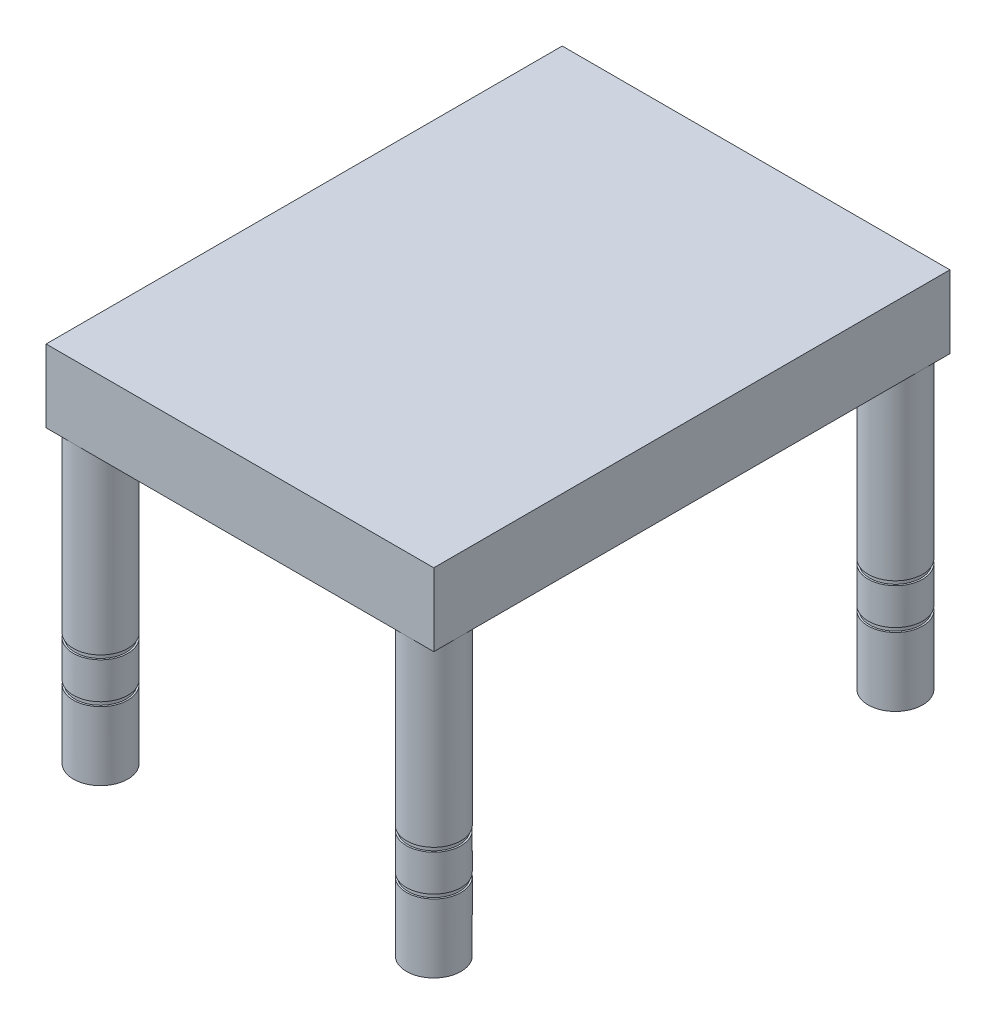
from build123d import *

# Parameters (mm, degrees)
SKETCH1_R             = 4.7625
BOSS_EXTRUDE1_DEPTH   = 50.8
BOSS_EXTRUDE1_2_DEPTH = 50.8
BOSS_EXTRUDE1_3_DEPTH = 50.8
BOSS_EXTRUDE1_4_DEPTH = 50.8
SKETCH2_W             = 67.765000106
SKETCH2_H             = 90.2184886
BOSS_EXTRUDE2_DEPTH   = 12.7
CUT_EXTRUDE1_START    = -0.7366
F_3DSKETCH1_R         = 4.7625
CUT_EXTRUDE1_DEPTH    = 0.7366
SKETCH3_R             = 4.4704
BOSS_EXTRUDE3_DEPTH   = 0.7366
F_3DSKETCH2_R         = 5.08
CUT_EXTRUDE2_DEPTH    = 0.7366
SKETCH4_R             = 4.4704
BOSS_EXTRUDE4_DEPTH   = 0.7366


with BuildPart() as part:
    # Sketch1 → Boss-Extrude1 (new body)
    with BuildSketch(Plane(origin=(0, 0, 0), x_dir=(1, 0, 0), z_dir=(0, 1, 0))):
        with Locations(Location((-29.1199951, 40.3467443, 0), (0, 0, 270))):
            Circle(SKETCH1_R)
    extrude(amount=BOSS_EXTRUDE1_DEPTH)



with BuildPart() as body_2:
    # Sketch1 → Boss-Extrude1 2 (new body)
    with BuildSketch(Plane(origin=(0, 0, 0), x_dir=(1, 0, 0), z_dir=(0, 1, 0))):
        with Locations(Location((-29.1199951, -40.3467443, 0), (0, 0, 270))):
            Circle(SKETCH1_R)
    extrude(amount=BOSS_EXTRUDE1_2_DEPTH)


with BuildPart() as body_3:
    # Sketch1 → Boss-Extrude1 3 (new body)
    with BuildSketch(Plane(origin=(0, 0, 0), x_dir=(1, 0, 0), z_dir=(0, 1, 0))):
        with Locations(Location((29.120005006, -40.3467443, 0), (0, 0, 270))):
            Circle(SKETCH1_R)
    extrude(amount=BOSS_EXTRUDE1_3_DEPTH)


with BuildPart() as body_4:
    # Sketch1 → Boss-Extrude1 4 (new body)
    with BuildSketch(Plane(origin=(0, 0, 0), x_dir=(1, 0, 0), z_dir=(0, 1, 0))):
        with Locations(Location((29.120005006, 40.3467443, 0), (0, 0, 270))):
            Circle(SKETCH1_R)
    extrude(amount=BOSS_EXTRUDE1_4_DEPTH)


with BuildPart() as part_1:
    add(part.part)

    add(body_2.part)  # Boss-Extrude2 merges body 2

    add(body_3.part)  # Boss-Extrude2 merges body 3

    add(body_4.part)  # Boss-Extrude2 merges body 4
    # Sketch2 → Boss-Extrude2 (add)
    with BuildSketch(Plane(origin=(0, 50.8, 0), x_dir=(1, 0, 0), z_dir=(0, 1, 0))):
        with Locations((4.953e-06, 0)):
            Rectangle(SKETCH2_W, SKETCH2_H)
    extrude(amount=BOSS_EXTRUDE2_DEPTH)

    # 3DSketch1 → Cut-Extrude1 (cut)
    with BuildSketch(Plane(origin=(-29.1199951, 12.7, 40.3467443), x_dir=(0.5852354085547554, 0, -0.8108634389178911), z_dir=(0, 1, 0)).offset(CUT_EXTRUDE1_START)):
        with Locations(Location((0, 0, 0), (0, 0, 35.819622287))):
            Circle(F_3DSKETCH1_R)
        with Locations(Location((34.084110256, -47.224686769, 0), (0, 0, 35.819622287))):
            Circle(F_3DSKETCH1_R)
        with Locations(Location((99.515509921, 0, 0), (0, 0, 35.819622287))):
            Circle(F_3DSKETCH1_R)
        with Locations(Location((65.431399664, 47.224686769, 0), (0, 0, 35.819622287))):
            Circle(F_3DSKETCH1_R)
    extrude(amount=CUT_EXTRUDE1_DEPTH, mode=Mode.SUBTRACT)


with BuildPart() as cut_extrude1_piece_1:
    # of the separate pieces the step leaves, piece 1, a body of its own (cut_extrude1_pieces)
    add(part_1.part.solids().sort_by_distance((-29.1199951, 12.7, -35.5842443))[0])



with BuildPart() as cut_extrude1_piece_2:
    # of the separate pieces the step leaves, piece 2, a body of its own (cut_extrude1_pieces)
    add(part_1.part.solids().sort_by_distance((-29.1199951, 0, 45.1092443))[0])


with BuildPart() as cut_extrude1_piece_3:
    # of the separate pieces the step leaves, piece 3, a body of its own (cut_extrude1_pieces)
    add(part_1.part.solids().sort_by_distance((-29.1199951, 0, -35.5842443))[0])


with BuildPart() as cut_extrude1_piece_4:
    # of the separate pieces the step leaves, piece 4, a body of its own (cut_extrude1_pieces)
    add(part_1.part.solids().sort_by_distance((29.120005006, 0, -35.5842443))[0])


with BuildPart() as cut_extrude1_piece_5:
    # of the separate pieces the step leaves, piece 5, a body of its own (cut_extrude1_pieces)
    add(part_1.part.solids().sort_by_distance((29.120005006, 0, 45.1092443))[0])


with BuildPart() as cut_extrude1_piece_1_1:
    add(cut_extrude1_piece_1.part)

    add(cut_extrude1_piece_2.part)  # Boss-Extrude3 merges Cut-Extrude1 piece 2

    add(cut_extrude1_piece_3.part)  # Boss-Extrude3 merges Cut-Extrude1 piece 3

    add(cut_extrude1_piece_4.part)  # Boss-Extrude3 merges Cut-Extrude1 piece 4

    add(cut_extrude1_piece_5.part)  # Boss-Extrude3 merges Cut-Extrude1 piece 5
    # Sketch3 → Boss-Extrude3 (add)
    with BuildSketch(Plane(origin=(0, 12.7, 0), x_dir=(-1, 0, 0), z_dir=(0, -1, 0))):
        with Locations(Location((29.1199951, 40.3467443, 0), (0, 0, 90))):
            Circle(SKETCH3_R)
        with Locations(Location((-29.120005006, 40.3467443, 0), (0, 0, 90))):
            Circle(SKETCH3_R)
        with Locations(Location((-29.120005006, -40.3467443, 0), (0, 0, 90))):
            Circle(SKETCH3_R)
        with Locations(Location((29.1199951, -40.3467443, 0), (0, 0, 90))):
            Circle(SKETCH3_R)
    extrude(amount=BOSS_EXTRUDE3_DEPTH)

    # 3DSketch2 → Cut-Extrude2 (cut)
    with BuildSketch(Plane(origin=(-29.1199951, 19.05, 40.3467443), x_dir=(0.5852354085547554, 0, -0.8108634389178911), z_dir=(0, 1, 0))):
        Circle(F_3DSKETCH2_R)
        with Locations((34.084110256, -47.224686769)):
            Circle(F_3DSKETCH2_R)
        with Locations((99.515509921, 0)):
            Circle(F_3DSKETCH2_R)
        with Locations((65.431399664, 47.224686769)):
            Circle(F_3DSKETCH2_R)
    extrude(amount=CUT_EXTRUDE2_DEPTH, mode=Mode.SUBTRACT)


with BuildPart() as cut_extrude2_piece_1:
    # of the separate pieces the step leaves, piece 1, a body of its own (cut_extrude2_pieces)
    add(cut_extrude1_piece_1_1.part.solids().sort_by_distance((29.120005006, 19.7866, 45.1092443))[0])



with BuildPart() as cut_extrude2_piece_2:
    # of the separate pieces the step leaves, piece 2, a body of its own (cut_extrude2_pieces)
    add(cut_extrude1_piece_1_1.part.solids().sort_by_distance((-29.1199951, 12.7, 45.1092443))[0])


with BuildPart() as cut_extrude2_piece_3:
    # of the separate pieces the step leaves, piece 3, a body of its own (cut_extrude2_pieces)
    add(cut_extrude1_piece_1_1.part.solids().sort_by_distance((-29.1199951, 12.7, -35.5842443))[0])


with BuildPart() as cut_extrude2_piece_4:
    # of the separate pieces the step leaves, piece 4, a body of its own (cut_extrude2_pieces)
    add(cut_extrude1_piece_1_1.part.solids().sort_by_distance((29.120005006, 12.7, -35.5842443))[0])


with BuildPart() as cut_extrude2_piece_5:
    # of the separate pieces the step leaves, piece 5, a body of its own (cut_extrude2_pieces)
    add(cut_extrude1_piece_1_1.part.solids().sort_by_distance((29.120005006, 0, 45.1092443))[0])


with BuildPart() as cut_extrude2_piece_1_1:
    add(cut_extrude2_piece_1.part)

    add(cut_extrude2_piece_2.part)  # Boss-Extrude4 merges Cut-Extrude2 piece 2

    add(cut_extrude2_piece_3.part)  # Boss-Extrude4 merges Cut-Extrude2 piece 3

    add(cut_extrude2_piece_4.part)  # Boss-Extrude4 merges Cut-Extrude2 piece 4

    add(cut_extrude2_piece_5.part)  # Boss-Extrude4 merges Cut-Extrude2 piece 5
    # Sketch4 → Boss-Extrude4 (add)
    with BuildSketch(Plane(origin=(0, 19.7866, 0), x_dir=(-1, 0, 0), z_dir=(0, -1, 0))):
        with Locations(Location((29.1199951, -40.3467443, 0), (0, 0, 270))):
            Circle(SKETCH4_R)
        with Locations(Location((-29.120005006, -40.3467443, 0), (0, 0, 270))):
            Circle(SKETCH4_R)
        with Locations(Location((-29.120005006, 40.3467443, 0), (0, 0, 270))):
            Circle(SKETCH4_R)
        with Locations(Location((29.1199951, 40.3467443, 0), (0, 0, 270))):
            Circle(SKETCH4_R)
    extrude(amount=BOSS_EXTRUDE4_DEPTH)


solid = cut_extrude2_piece_1_1.part
